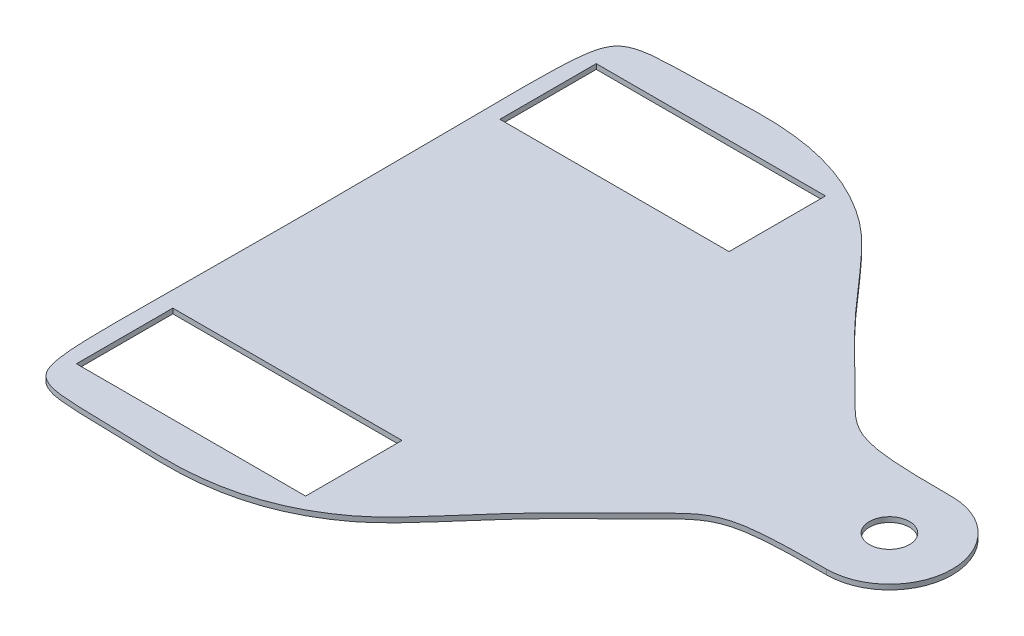
from build123d import *

# Parameters (mm, degrees)
BASE_DIMENSIONS_W   = 17
BASE_DIMENSIONS_H   = 55
BASE_DIMENSIONS_W_2 = 16
BASE_DIMENSIONS_H_2 = 82.2
BOSS_EXTRUDE1_DEPTH = 1.2
SKETCH2_W           = 54.8
SKETCH2_H           = 23.05
CUT_EXTRUDE1_DEPTH  = 154.667274543
SKETCH4_R           = 4.7879
CUT_EXTRUDE2_DEPTH  = 154.667274543


with BuildPart() as part:
    # base dimensions → Boss-Extrude1 (new body)
    # profile 1 of 7: a face of its own
    with BuildSketch(Plane(origin=(0, 0, 0), x_dir=(1, 0, 0), z_dir=(0, 1, 0))):
        with BuildLine():
            ThreePointArc((0, -15), (10.606601718, -10.606601718), (15, 0))
            ThreePointArc((15, 0), (10.606601718, 10.606601718), (0, 15))
            ThreePointArc((0, 15), (-15, 0), (0, -15))
        make_face()
    # profile 2 of 7: a face of its own
    with BuildSketch(Plane(origin=(0, 0, 0), x_dir=(1, 0, 0), z_dir=(0, 1, 0))):
        with BuildLine():
            ThreePointArc((0, -15), (-15, 0), (0, 15))
            add(Edge.make_bspline(
                [(0, 15), (-26.059666114, 15), (-24.298419505, 16.87620625), (-51.00856213, 41.98152431), (-61.289566768, 55.94473541), (-79.953121155, 69.692083036), (-95.015762161, 71.716255609), (-110.818983437, 71.005231253), (-126.52199389, 70.874100177), (-138.142838543, 68.217935499), (-135.85, 61.151104159), (-135.85, 0)],
                knots=[0, 0, 0, 0, 0.141137685, 0.170317061, 0.278296352, 0.317035273, 0.518967354, 0.554462651, 0.636492949, 0.682072063, 1, 1, 1, 1], degree=3))
            add(Edge.make_bspline(
                [(0, -15), (-26.059666114, -15), (-24.298419505, -16.87620625), (-51.00856213, -41.98152431), (-61.289566768, -55.94473541), (-79.953121155, -69.692083036), (-95.015762161, -71.716255609), (-110.818983437, -71.005231253), (-126.52199389, -70.874100177), (-138.142838543, -68.217935499), (-135.85, -61.151104159), (-135.85, 0)],
                knots=[0, 0, 0, 0, 0.141137685, 0.170317061, 0.278296352, 0.317035273, 0.518967354, 0.554462651, 0.636492949, 0.682072063, 1, 1, 1, 1], degree=3))
        make_face()
        with Locations((-123.35, 0)):
            Rectangle(BASE_DIMENSIONS_W, BASE_DIMENSIONS_H, mode=Mode.SUBTRACT)
        Polygon((-112.85, -41.1), (-112.85, 41.1), (-130.25, 41.1), (-130.25, 60.15), (-79.45, 60.15), (-79.45, 41.1), (-96.85, 41.1), (-96.85, -41.1), (-79.45, -41.1), (-79.45, -60.15), (-130.25, -60.15), (-130.25, -41.1), align=None, mode=Mode.SUBTRACT)
        with BuildLine():
            ThreePointArc((-94.85, 0), (-81, 13.85), (-67.15, 0))
            ThreePointArc((-67.15, 0), (-81, -13.85), (-94.85, 0))
        make_face(mode=Mode.SUBTRACT)
    # profile 3 of 7: a face of its own
    with BuildSketch(Plane(origin=(0, 0, 0), x_dir=(1, 0, 0), z_dir=(0, 1, 0))):
        with Locations((-123.35, 0)):
            Rectangle(BASE_DIMENSIONS_W, BASE_DIMENSIONS_H)
    # profile 4 of 7: a face of its own
    with BuildSketch(Plane(origin=(0, 0, 0), x_dir=(1, 0, 0), z_dir=(0, 1, 0))):
        Polygon((-96.85, -41.1), (-112.85, -41.1), (-130.25, -41.1), (-130.25, -60.15), (-79.45, -60.15), (-79.45, -41.1), align=None)
    # profile 5 of 7: a face of its own
    with BuildSketch(Plane(origin=(0, 0, 0), x_dir=(1, 0, 0), z_dir=(0, 1, 0))):
        Polygon((-130.25, 41.1), (-112.85, 41.1), (-96.85, 41.1), (-79.45, 41.1), (-79.45, 60.15), (-130.25, 60.15), align=None)
    # profile 6 of 7: a face of its own
    with BuildSketch(Plane(origin=(0, 0, 0), x_dir=(1, 0, 0), z_dir=(0, 1, 0))):
        with Locations((-104.85, 0)):
            Rectangle(BASE_DIMENSIONS_W_2, BASE_DIMENSIONS_H_2)
    # profile 7 of 7: a face of its own
    with BuildSketch(Plane(origin=(0, 0, 0), x_dir=(1, 0, 0), z_dir=(0, 1, 0))):
        with BuildLine():
            ThreePointArc((-94.85, 0), (-81, -13.85), (-67.15, 0))
            ThreePointArc((-67.15, 0), (-81, 13.85), (-94.85, 0))
        make_face()
    extrude(amount=-BOSS_EXTRUDE1_DEPTH)

    # Sketch2 → Cut-Extrude1 (cut, through all)
    with BuildSketch(Plane(origin=(0, -1.2, 0), x_dir=(-1, 0, 0), z_dir=(0, -1, 0))):
        with Locations((104.85, 50.625)):
            Rectangle(SKETCH2_W, SKETCH2_H)
        with Locations((104.85, -50.625)):
            Rectangle(SKETCH2_W, SKETCH2_H)
    extrude(amount=-CUT_EXTRUDE1_DEPTH, mode=Mode.SUBTRACT)

    # Sketch4 → Cut-Extrude2 (cut, through all)
    with BuildSketch(Plane(origin=(0, 0, 0), x_dir=(1, 0, 0), z_dir=(0, 1, 0))):
        with Locations(Location((0, 0, 0), (0, 0, 270))):
            Circle(SKETCH4_R)
    extrude(amount=-CUT_EXTRUDE2_DEPTH, mode=Mode.SUBTRACT)


solid = part.part
